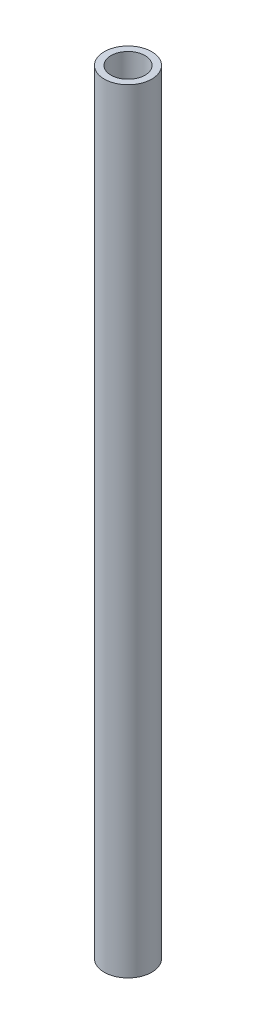
from build123d import *

# Parameters (mm, degrees)
SKETCH1_R           = 17.5
SKETCH1_R_2         = 12.5
BOSS_EXTRUDE1_DEPTH = 280
SKETCH8_R           = 17.5
BOSS_EXTRUDE3_DEPTH = 10
SKETCH9_R           = 12.55
CUT_EXTRUDE2_DEPTH  = 899.5


with BuildPart() as part:
    # Sketch1 → Boss-Extrude1 (new, symmetric)
    with BuildSketch(Plane(origin=(0, 0, 0), x_dir=(1, 0, 0), z_dir=(0, 1, 0))):
        Circle(SKETCH1_R)
        Circle(SKETCH1_R_2, mode=Mode.SUBTRACT)
    extrude(amount=BOSS_EXTRUDE1_DEPTH, both=True)

    # Sketch8 → Boss-Extrude3 (add)
    with BuildSketch(Plane.XZ.offset(280)):
        Circle(SKETCH8_R)
    extrude(amount=BOSS_EXTRUDE3_DEPTH)

    # Sketch9 → Cut-Extrude2 (cut)
    with BuildSketch(Plane(origin=(-32.302786122, 416.289190775, -45.221901395), x_dir=(-0.9768887275019512, 0, 0.2137484832217963), z_dir=(0, 1, 0))):
        with Locations((-21.890114798, 51.081437247)):
            Circle(SKETCH9_R)
    extrude(amount=-CUT_EXTRUDE2_DEPTH, mode=Mode.SUBTRACT)


solid = part.part
